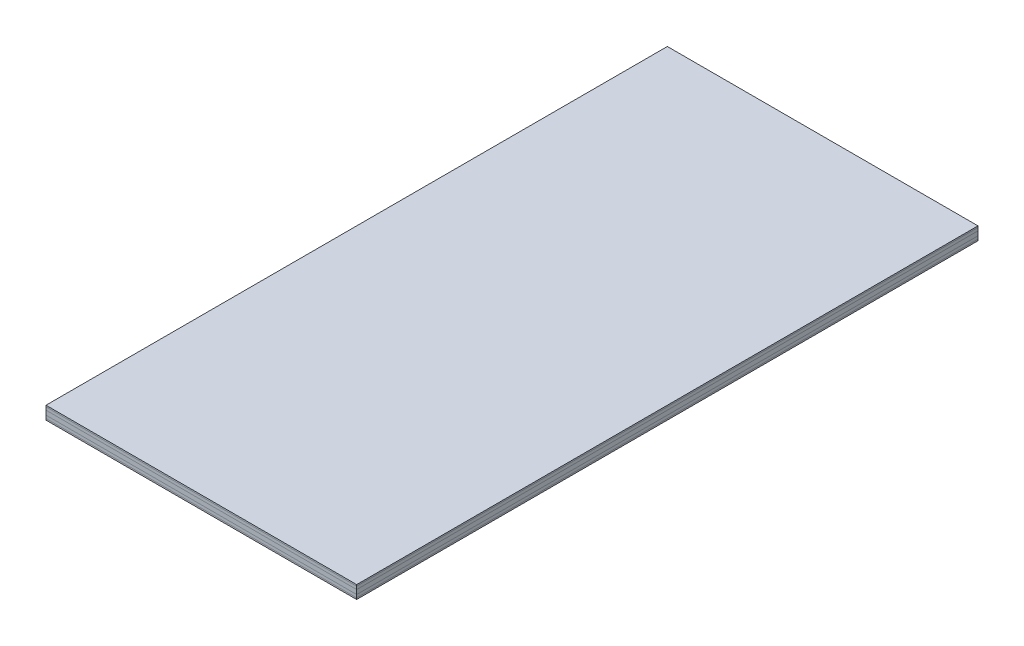
from build123d import *

# Parameters (mm, degrees)
SKETCH3_W                = 609.6
SKETCH3_H                = 1219.2
BOSS_EXTRUDE1_DEPTH      = 25.4
SPLIT1_SURFACE_1_1_BACK  = 1364.344
SPLIT1_SURFACE_1_1_DEPTH = 2728.688
SPLIT1_SURFACE_1_2_BACK  = 1364.344
SPLIT1_SURFACE_1_2_DEPTH = 2728.688
SPLIT1_SURFACE_2_3_BACK  = 1364.344
SPLIT1_SURFACE_2_3_DEPTH = 2728.688
SPLIT1_SURFACE_2_4_BACK  = 1364.344
SPLIT1_SURFACE_2_4_DEPTH = 2728.688
SPLIT1_SURFACE_3_5_BACK  = 1364.344
SPLIT1_SURFACE_3_5_DEPTH = 2728.688
SPLIT1_SURFACE_3_6_BACK  = 1364.344
SPLIT1_SURFACE_3_6_DEPTH = 2728.688
SPLIT1_SURFACE_4_7_BACK  = 1364.344
SPLIT1_SURFACE_4_7_DEPTH = 2728.688
SPLIT1_SURFACE_4_8_BACK  = 1364.344
SPLIT1_SURFACE_4_8_DEPTH = 2728.688


with BuildPart() as part:
    # Sketch3 → Boss-Extrude1 (new body)
    with BuildSketch(Plane(origin=(0, 0, 0), x_dir=(1, 0, 0), z_dir=(0, 1, 0))):
        Rectangle(SKETCH3_W, SKETCH3_H)
    extrude(amount=-BOSS_EXTRUDE1_DEPTH)


with BuildPart() as body_2:
    # Split1: the piece behind the surface
    add(part.part)
    # Split1 surface 1: a surface, the sketch's curves swept straight by 2728.688 mm
    with BuildLine(Plane.XY.offset(-SPLIT1_SURFACE_1_1_BACK), mode=Mode.PRIVATE) as split1_surface_1_1_path:
        Line((-335.28, -22.577777778), (335.28, -22.577777778))
    split1_surface_1_1 = Shell.extrude(split1_surface_1_1_path.wire(), (0 * SPLIT1_SURFACE_1_1_DEPTH, 0 * SPLIT1_SURFACE_1_1_DEPTH, 1 * SPLIT1_SURFACE_1_1_DEPTH))
    split(bisect_by=split1_surface_1_1, keep=Keep.BOTTOM)


with BuildPart() as part_1:
    add(part.part)

    # Split1: split by a surface, the side it looks to stays
    # Split1 surface 1: a surface, the sketch's curves swept straight by 2728.688 mm
    with BuildLine(Plane.XY.offset(-SPLIT1_SURFACE_1_2_BACK), mode=Mode.PRIVATE) as split1_surface_1_2_path:
        Line((-335.28, -22.577777778), (335.28, -22.577777778))
    split1_surface_1_2 = Shell.extrude(split1_surface_1_2_path.wire(), (0 * SPLIT1_SURFACE_1_2_DEPTH, 0 * SPLIT1_SURFACE_1_2_DEPTH, 1 * SPLIT1_SURFACE_1_2_DEPTH))
    split(bisect_by=split1_surface_1_2, keep=Keep.TOP)


with BuildPart() as body_3:
    # Split1 2: the piece behind the surface
    add(part_1.part)
    # Split1 surface 2: a surface, the sketch's curves swept straight by 2728.688 mm
    with BuildLine(Plane.XY.offset(-SPLIT1_SURFACE_2_3_BACK), mode=Mode.PRIVATE) as split1_surface_2_3_path:
        Line((-335.28, -16.933333333), (335.28, -16.933333333))
    split1_surface_2_3 = Shell.extrude(split1_surface_2_3_path.wire(), (0 * SPLIT1_SURFACE_2_3_DEPTH, 0 * SPLIT1_SURFACE_2_3_DEPTH, 1 * SPLIT1_SURFACE_2_3_DEPTH))
    split(bisect_by=split1_surface_2_3, keep=Keep.BOTTOM)


with BuildPart() as part_2:
    add(part_1.part)

    # Split1 2: split by a surface, the side it looks to stays
    # Split1 surface 2: a surface, the sketch's curves swept straight by 2728.688 mm
    with BuildLine(Plane.XY.offset(-SPLIT1_SURFACE_2_4_BACK), mode=Mode.PRIVATE) as split1_surface_2_4_path:
        Line((-335.28, -16.933333333), (335.28, -16.933333333))
    split1_surface_2_4 = Shell.extrude(split1_surface_2_4_path.wire(), (0 * SPLIT1_SURFACE_2_4_DEPTH, 0 * SPLIT1_SURFACE_2_4_DEPTH, 1 * SPLIT1_SURFACE_2_4_DEPTH))
    split(bisect_by=split1_surface_2_4, keep=Keep.TOP)


with BuildPart() as body_4_2:
    # Split1 3: the piece behind the surface
    add(part_2.part)
    # Split1 surface 3: a surface, the sketch's curves swept straight by 2728.688 mm
    with BuildLine(Plane.XY.offset(-SPLIT1_SURFACE_3_5_BACK), mode=Mode.PRIVATE) as split1_surface_3_5_path:
        Line((-335.28, -2.822222222), (335.28, -2.822222222))
    split1_surface_3_5 = Shell.extrude(split1_surface_3_5_path.wire(), (0 * SPLIT1_SURFACE_3_5_DEPTH, 0 * SPLIT1_SURFACE_3_5_DEPTH, 1 * SPLIT1_SURFACE_3_5_DEPTH))
    split(bisect_by=split1_surface_3_5, keep=Keep.BOTTOM)


with BuildPart() as part_3:
    add(part_2.part)

    # Split1 3: split by a surface, the side it looks to stays
    # Split1 surface 3: a surface, the sketch's curves swept straight by 2728.688 mm
    with BuildLine(Plane.XY.offset(-SPLIT1_SURFACE_3_6_BACK), mode=Mode.PRIVATE) as split1_surface_3_6_path:
        Line((-335.28, -2.822222222), (335.28, -2.822222222))
    split1_surface_3_6 = Shell.extrude(split1_surface_3_6_path.wire(), (0 * SPLIT1_SURFACE_3_6_DEPTH, 0 * SPLIT1_SURFACE_3_6_DEPTH, 1 * SPLIT1_SURFACE_3_6_DEPTH))
    split(bisect_by=split1_surface_3_6, keep=Keep.TOP)


with BuildPart() as body_5_2:
    # Split1 4 body 4 2: the piece behind the surface
    add(body_4_2.part)
    # Split1 surface 4: a surface, the sketch's curves swept straight by 2728.688 mm
    with BuildLine(Plane.XY.offset(-SPLIT1_SURFACE_4_7_BACK), mode=Mode.PRIVATE) as split1_surface_4_7_path:
        Line((-335.28, -8.466666667), (335.28, -8.466666667))
    split1_surface_4_7 = Shell.extrude(split1_surface_4_7_path.wire(), (0 * SPLIT1_SURFACE_4_7_DEPTH, 0 * SPLIT1_SURFACE_4_7_DEPTH, 1 * SPLIT1_SURFACE_4_7_DEPTH))
    split(bisect_by=split1_surface_4_7, keep=Keep.BOTTOM)


with BuildPart() as body_4_2_1:
    add(body_4_2.part)

    # Split1 4 body 4 2: split by a surface, the side it looks to stays
    # Split1 surface 4: a surface, the sketch's curves swept straight by 2728.688 mm
    with BuildLine(Plane.XY.offset(-SPLIT1_SURFACE_4_8_BACK), mode=Mode.PRIVATE) as split1_surface_4_8_path:
        Line((-335.28, -8.466666667), (335.28, -8.466666667))
    split1_surface_4_8 = Shell.extrude(split1_surface_4_8_path.wire(), (0 * SPLIT1_SURFACE_4_8_DEPTH, 0 * SPLIT1_SURFACE_4_8_DEPTH, 1 * SPLIT1_SURFACE_4_8_DEPTH))
    split(bisect_by=split1_surface_4_8, keep=Keep.TOP)


solid = Compound([body_2.part, body_3.part, part_3.part, body_5_2.part, body_4_2_1.part])
